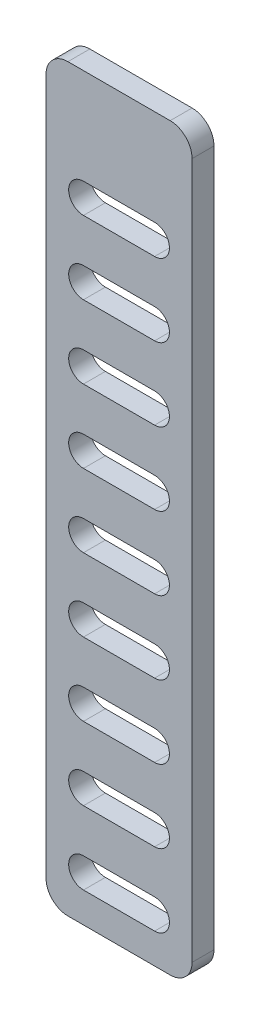
from build123d import *

# Parameters (mm, degrees)
SKETCH1_W           = 20
SKETCH1_H           = 101.315398587
BOSS_EXTRUDE1_DEPTH = 3
FILLET1_R           = 3


with BuildPart() as part:
    # Sketch1 → Boss-Extrude1 (new body)
    with BuildSketch(Plane.XY):
        with Locations((-91.066816784, 84.566254488)):
            Rectangle(SKETCH1_W, SKETCH1_H)
        with BuildLine():
            Line((-86.19596438, 38.053580074), (-95.937669189, 38.053580074))
            ThreePointArc((-95.937669189, 38.053580074), (-97.965327886, 40.081238771), (-95.937669189, 42.108897468))
            Line((-95.937669189, 42.108897468), (-86.19596438, 42.108897468))
            ThreePointArc((-86.19596438, 42.108897468), (-84.168305683, 40.081238771), (-86.19596438, 38.053580074))
        make_face(mode=Mode.SUBTRACT)
        with BuildLine():
            Line((-86.19596438, 48.053580074), (-95.937669189, 48.053580074))
            ThreePointArc((-95.937669189, 48.053580074), (-97.965327886, 50.081238771), (-95.937669189, 52.108897468))
            Line((-95.937669189, 52.108897468), (-86.19596438, 52.108897468))
            ThreePointArc((-86.19596438, 52.108897468), (-84.168305683, 50.081238771), (-86.19596438, 48.053580074))
        make_face(mode=Mode.SUBTRACT)
        with BuildLine():
            Line((-86.19596438, 58.053580074), (-95.937669189, 58.053580074))
            ThreePointArc((-95.937669189, 58.053580074), (-97.965327886, 60.081238771), (-95.937669189, 62.108897468))
            Line((-95.937669189, 62.108897468), (-86.19596438, 62.108897468))
            ThreePointArc((-86.19596438, 62.108897468), (-84.168305683, 60.081238771), (-86.19596438, 58.053580074))
        make_face(mode=Mode.SUBTRACT)
        with BuildLine():
            Line((-86.19596438, 68.053580074), (-95.937669189, 68.053580074))
            ThreePointArc((-95.937669189, 68.053580074), (-97.965327886, 70.081238771), (-95.937669189, 72.108897468))
            Line((-95.937669189, 72.108897468), (-86.19596438, 72.108897468))
            ThreePointArc((-86.19596438, 72.108897468), (-84.168305683, 70.081238771), (-86.19596438, 68.053580074))
        make_face(mode=Mode.SUBTRACT)
        with BuildLine():
            Line((-86.19596438, 78.053580074), (-95.937669189, 78.053580074))
            ThreePointArc((-95.937669189, 78.053580074), (-97.965327886, 80.081238771), (-95.937669189, 82.108897468))
            Line((-95.937669189, 82.108897468), (-86.19596438, 82.108897468))
            ThreePointArc((-86.19596438, 82.108897468), (-84.168305683, 80.081238771), (-86.19596438, 78.053580074))
        make_face(mode=Mode.SUBTRACT)
        with BuildLine():
            Line((-86.19596438, 88.053580074), (-95.937669189, 88.053580074))
            ThreePointArc((-95.937669189, 88.053580074), (-97.965327886, 90.081238771), (-95.937669189, 92.108897468))
            Line((-95.937669189, 92.108897468), (-86.19596438, 92.108897468))
            ThreePointArc((-86.19596438, 92.108897468), (-84.168305683, 90.081238771), (-86.19596438, 88.053580074))
        make_face(mode=Mode.SUBTRACT)
        with BuildLine():
            Line((-86.19596438, 98.053580074), (-95.937669189, 98.053580074))
            ThreePointArc((-95.937669189, 98.053580074), (-97.965327886, 100.081238771), (-95.937669189, 102.108897468))
            Line((-95.937669189, 102.108897468), (-86.19596438, 102.108897468))
            ThreePointArc((-86.19596438, 102.108897468), (-84.168305683, 100.081238771), (-86.19596438, 98.053580074))
        make_face(mode=Mode.SUBTRACT)
        with BuildLine():
            Line((-86.19596438, 108.053580074), (-95.937669189, 108.053580074))
            ThreePointArc((-95.937669189, 108.053580074), (-97.965327886, 110.081238771), (-95.937669189, 112.108897468))
            Line((-95.937669189, 112.108897468), (-86.19596438, 112.108897468))
            ThreePointArc((-86.19596438, 112.108897468), (-84.168305683, 110.081238771), (-86.19596438, 108.053580074))
        make_face(mode=Mode.SUBTRACT)
        with BuildLine():
            Line((-86.19596438, 118.053580074), (-95.937669189, 118.053580074))
            ThreePointArc((-95.937669189, 118.053580074), (-97.965327886, 120.081238771), (-95.937669189, 122.108897468))
            Line((-95.937669189, 122.108897468), (-86.19596438, 122.108897468))
            ThreePointArc((-86.19596438, 122.108897468), (-84.168305683, 120.081238771), (-86.19596438, 118.053580074))
        make_face(mode=Mode.SUBTRACT)
    extrude(amount=BOSS_EXTRUDE1_DEPTH)

    # Fillet1
    fillet1_edges = [part.edges().sort_by_distance(p)[0] for p in [
        (-101.066816784, 135.223953781, 1.5),
        (-81.066816784, 135.223953781, 1.5),
        (-81.066816784, 33.908555194, 1.5),
        (-101.066816784, 33.908555194, 1.5),
    ]]
    fillet(fillet1_edges, radius=FILLET1_R)


solid = part.part
